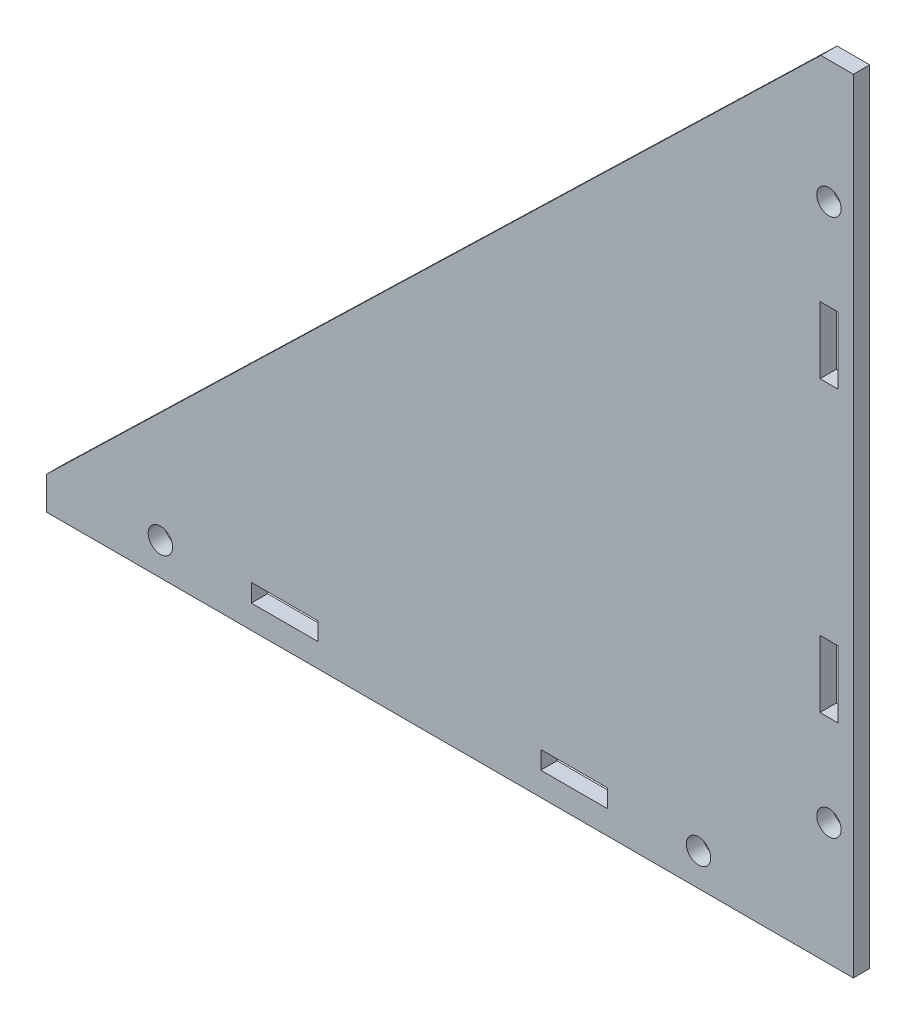
from build123d import *

# Parameters (mm, degrees)
SKETCH_1_R      = 1.5
SKETCH_1_W      = 8.2
SKETCH_1_H      = 2.2
SKETCH_1_W_2    = 2.2
SKETCH_1_H_2    = 8.2
EXTRUDE_1_DEPTH = 2


with BuildPart() as part:
    # 草图1 → 凸台-拉伸1 (new body)
    with BuildSketch(Plane.XY):
        Polygon((44.733844386, -118.574512395), (48.733844386, -118.574512395), (49.733844386, -118.574512395), (49.733844386, -22.574512395), (45.733844386, -22.574512395), (-49.266155614, -114.574512396), (-49.266155614, -118.574512395), (-3.266155614, -118.574512395), align=None)
        with Locations((-35.266155614, -114.574512396)):
            Circle(SKETCH_1_R, mode=Mode.SUBTRACT)
        with Locations(Location((30.733844386, -114.574512396, 0), (0, 0, 180))):
            Circle(SKETCH_1_R, mode=Mode.SUBTRACT)
        with Locations((46.733844387, -103.574512395)):
            Circle(SKETCH_1_R, mode=Mode.SUBTRACT)
        with Locations(Location((46.733844387, -37.616179062, 0), (0, 0, 180))):
            Circle(SKETCH_1_R, mode=Mode.SUBTRACT)
        with Locations((-20.016155614, -114.574512396)):
            Rectangle(SKETCH_1_W, SKETCH_1_H, mode=Mode.SUBTRACT)
        with Locations((15.483844386, -114.574512396)):
            Rectangle(SKETCH_1_W, SKETCH_1_H, mode=Mode.SUBTRACT)
        with Locations((46.733844387, -88.324512395)):
            Rectangle(SKETCH_1_W_2, SKETCH_1_H_2, mode=Mode.SUBTRACT)
        with Locations((46.733844387, -52.866179062)):
            Rectangle(SKETCH_1_W_2, SKETCH_1_H_2, mode=Mode.SUBTRACT)
    extrude(amount=EXTRUDE_1_DEPTH)


solid = part.part
